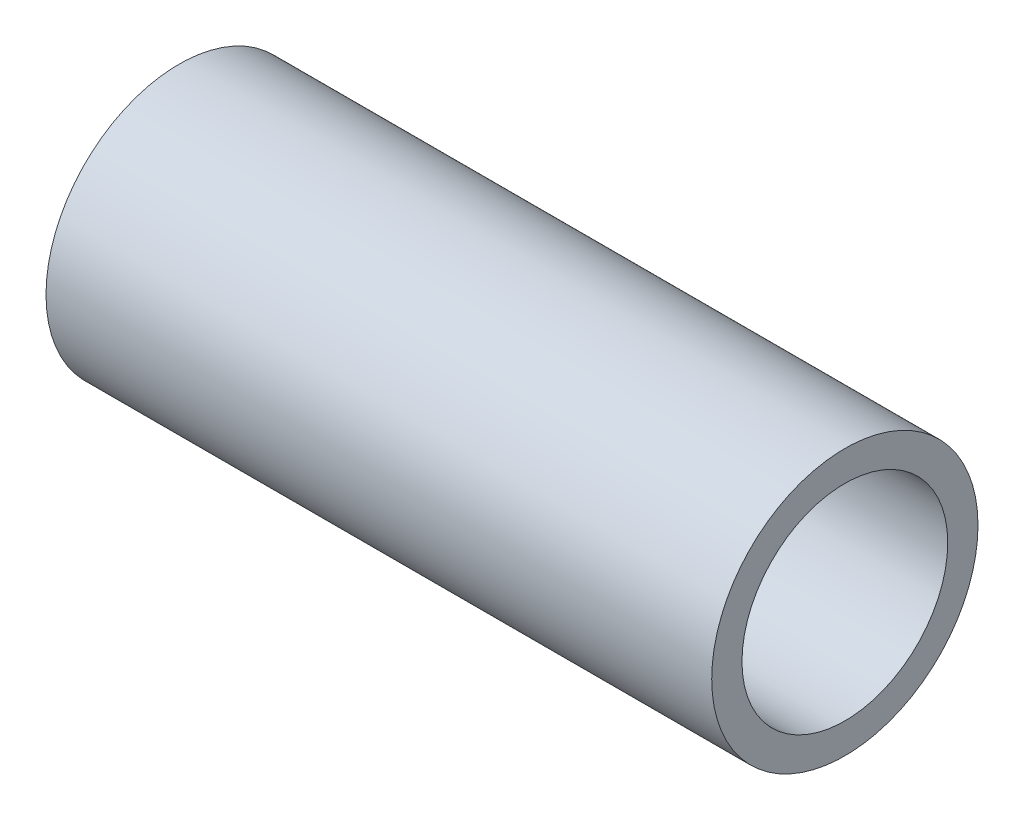
from build123d import *

# Parameters (mm, degrees)
SKETCH1_R           = 11
SKETCH1_R_2         = 8.5
BOSS_EXTRUDE1_DEPTH = 55


with BuildPart() as part:
    # Sketch1 → Boss-Extrude1 (new body)
    with BuildSketch(Plane(origin=(0, 0, 0), x_dir=(0, 0, -1), z_dir=(1, 0, 0))):
        Circle(SKETCH1_R)
        Circle(SKETCH1_R_2, mode=Mode.SUBTRACT)
    extrude(amount=BOSS_EXTRUDE1_DEPTH)


solid = part.part
